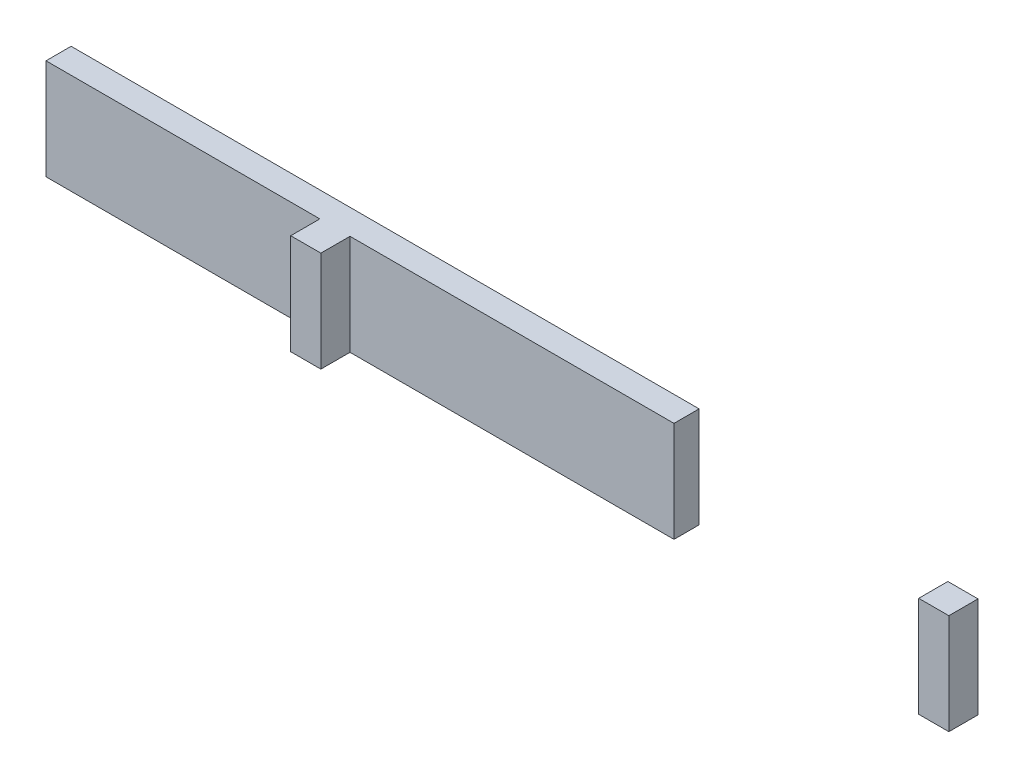
from build123d import *

# Parameters (mm, degrees)
ESQUISSE1_W        = 250
ESQUISSE1_H        = 40
BOSS_EXTRU_1_DEPTH = 10
ESQUISSE2_W        = 12
ESQUISSE2_H        = 40
BOSS_EXTRU_2_DEPTH = 11.6


with BuildPart() as part:
    # Esquisse1 → Boss.-Extru.1 (new body)
    with BuildSketch(Plane.XY):
        with Locations((125, 20)):
            Rectangle(ESQUISSE1_W, ESQUISSE1_H)
    extrude(amount=BOSS_EXTRU_1_DEPTH)

    # Esquisse2 → Boss.-Extru.2 (add)
    with BuildSketch(Plane.XY.offset(10)):
        with Locations((115.02, 20)):
            Rectangle(ESQUISSE2_W, ESQUISSE2_H)
        with Locations((365.02, 20)):
            Rectangle(ESQUISSE2_W, ESQUISSE2_H)
    extrude(amount=BOSS_EXTRU_2_DEPTH)


with BuildPart() as boss_extru_2_piece_1:
    # of the separate pieces the step leaves, piece 1, a body of its own (boss_extru_2_pieces)
    add(part.part.solids().sort_by_distance((0, 0, 0))[0])


with BuildPart() as boss_extru_2_piece_2:
    # of the separate pieces the step leaves, piece 2, a body of its own (boss_extru_2_pieces)
    add(part.part.solids().sort_by_distance((359.02, 40, 10))[0])


solid = Compound([boss_extru_2_piece_1.part, boss_extru_2_piece_2.part])
